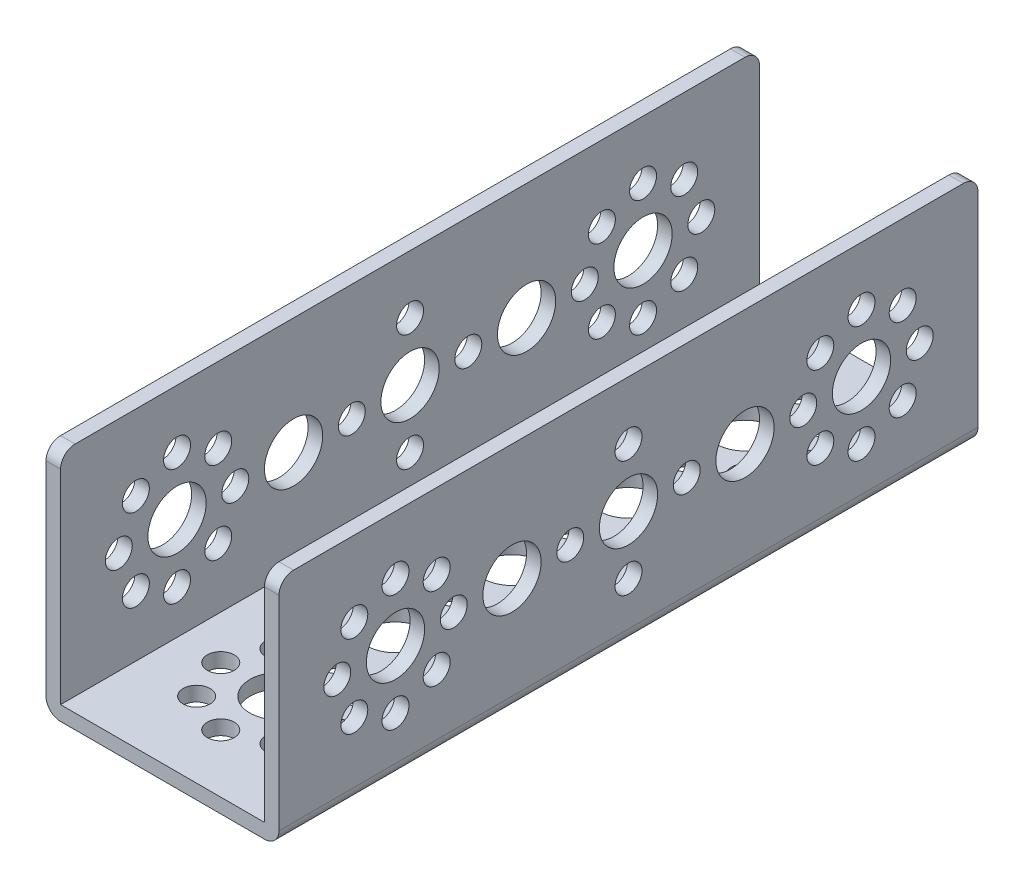
from build123d import *

# Parameters (mm, degrees)
BOSS_EXTRUDE1_DEPTH = 48
SKETCH2_R           = 4
SKETCH2_R_2         = 1.85
CUT_EXTRUDE1_DEPTH  = 32
SKETCH6_R           = 4
SKETCH6_R_2         = 1.85
CUT_EXTRUDE2_DEPTH  = 2
FILLET1_R           = 2


with BuildPart() as part:
    # Sketch1 → Boss-Extrude1 (new, symmetric)
    with BuildSketch(Plane.XY):
        with BuildLine():
            Line((-14, 0), (14, 0))
            ThreePointArc((14, 0), (15.414213562, 0.585786438), (16, 2))
            Line((16, 2), (16, 32))
            Line((16, 32), (14, 32))
            Line((14, 32), (14, 2))
            Line((14, 2), (-14, 2))
            Line((-14, 2), (-14, 32))
            Line((-14, 32), (-16, 32))
            Line((-16, 32), (-16, 2))
            ThreePointArc((-16, 2), (-15.414213562, 0.585786438), (-14, 0))
        make_face()
    extrude(amount=BOSS_EXTRUDE1_DEPTH, both=True)

    # Sketch2 → Cut-Extrude1 (cut)
    with BuildSketch(Plane(origin=(16, 0, 0), x_dir=(0, 0, -1), z_dir=(1, 0, 0))):
        with Locations((0, 16)):
            Circle(SKETCH2_R)
        with Locations((8, 16)):
            Circle(SKETCH2_R_2)
        with Locations((-8, 16)):
            Circle(SKETCH2_R_2)
        with Locations((0, 8)):
            Circle(SKETCH2_R_2)
        with Locations((0, 24)):
            Circle(SKETCH2_R_2)
        with Locations((-16, 16)):
            Circle(SKETCH2_R)
        with Locations((16, 16)):
            Circle(SKETCH2_R)
        with Locations((40, 16)):
            Circle(SKETCH2_R_2)
        with Locations((32, 8)):
            Circle(SKETCH2_R_2)
        with Locations((32, 16)):
            Circle(SKETCH2_R)
        with Locations((32, 24)):
            Circle(SKETCH2_R_2)
        with Locations((26.343145751, 21.656854249)):
            Circle(SKETCH2_R_2)
        with Locations((26.343145751, 10.343145751)):
            Circle(SKETCH2_R_2)
        with Locations((24, 16)):
            Circle(SKETCH2_R_2)
        with Locations((37.656854249, 21.656854249)):
            Circle(SKETCH2_R_2)
        with Locations((37.656854249, 10.343145751)):
            Circle(SKETCH2_R_2)
        with Locations((-24, 16)):
            Circle(SKETCH2_R_2)
        with Locations((-32, 8)):
            Circle(SKETCH2_R_2)
        with Locations((-32, 16)):
            Circle(SKETCH2_R)
        with Locations((-32, 24)):
            Circle(SKETCH2_R_2)
        with Locations((-37.656854249, 21.656854249)):
            Circle(SKETCH2_R_2)
        with Locations((-37.656854249, 10.343145751)):
            Circle(SKETCH2_R_2)
        with Locations((-40, 16)):
            Circle(SKETCH2_R_2)
        with Locations((-26.343145751, 21.656854249)):
            Circle(SKETCH2_R_2)
        with Locations((-26.343145751, 10.343145751)):
            Circle(SKETCH2_R_2)
    extrude(amount=-CUT_EXTRUDE1_DEPTH, mode=Mode.SUBTRACT)

    # Sketch6 → Cut-Extrude2 (cut)
    with BuildSketch(Plane(origin=(0, 2, 0), x_dir=(1, 0, 0), z_dir=(0, 1, 0))):
        with Locations(Location((0, 0, 0), (0, 0, 180))):
            Circle(SKETCH6_R)
        with Locations(Location((0, 8, 0), (0, 0, 180))):
            Circle(SKETCH6_R_2)
        with Locations(Location((0, -8, 0), (0, 0, 180))):
            Circle(SKETCH6_R_2)
        with Locations(Location((8, 0, 0), (0, 0, 180))):
            Circle(SKETCH6_R_2)
        with Locations(Location((-8, 0, 0), (0, 0, 180))):
            Circle(SKETCH6_R_2)
        with Locations(Location((0, -16, 0), (0, 0, 180))):
            Circle(SKETCH6_R)
        with Locations(Location((0, 16, 0), (0, 0, 180))):
            Circle(SKETCH6_R)
        with Locations(Location((0, 24, 0), (0, 0, 180))):
            Circle(SKETCH6_R_2)
        with Locations(Location((-8, 32, 0), (0, 0, 180))):
            Circle(SKETCH6_R_2)
        with Locations(Location((0, 32, 0), (0, 0, 180))):
            Circle(SKETCH6_R)
        with Locations(Location((8, 32, 0), (0, 0, 180))):
            Circle(SKETCH6_R_2)
        with Locations(Location((5.656854249, 37.656854249, 0), (0, 0, 180))):
            Circle(SKETCH6_R_2)
        with Locations(Location((-5.656854249, 37.656854249, 0), (0, 0, 180))):
            Circle(SKETCH6_R_2)
        with Locations(Location((0, 40, 0), (0, 0, 180))):
            Circle(SKETCH6_R_2)
        with Locations(Location((5.656854249, 26.343145751, 0), (0, 0, 180))):
            Circle(SKETCH6_R_2)
        with Locations(Location((-5.656854249, 26.343145751, 0), (0, 0, 180))):
            Circle(SKETCH6_R_2)
        with Locations(Location((0, -40, 0), (0, 0, 180))):
            Circle(SKETCH6_R_2)
        with Locations(Location((-8, -32, 0), (0, 0, 180))):
            Circle(SKETCH6_R_2)
        with Locations(Location((0, -32, 0), (0, 0, 180))):
            Circle(SKETCH6_R)
        with Locations(Location((8, -32, 0), (0, 0, 180))):
            Circle(SKETCH6_R_2)
        with Locations(Location((5.656854249, -26.343145751, 0), (0, 0, 180))):
            Circle(SKETCH6_R_2)
        with Locations(Location((-5.656854249, -26.343145751, 0), (0, 0, 180))):
            Circle(SKETCH6_R_2)
        with Locations(Location((0, -24, 0), (0, 0, 180))):
            Circle(SKETCH6_R_2)
        with Locations(Location((5.656854249, -37.656854249, 0), (0, 0, 180))):
            Circle(SKETCH6_R_2)
        with Locations(Location((-5.656854249, -37.656854249, 0), (0, 0, 180))):
            Circle(SKETCH6_R_2)
    extrude(amount=-CUT_EXTRUDE2_DEPTH, mode=Mode.SUBTRACT)

    # Fillet1
    fillet1_edges = [part.edges().sort_by_distance(p)[0] for p in [
        (15, 32, -48),
        (15, 32, 48),
        (-15, 32, 48),
        (-15, 32, -48),
    ]]
    fillet(fillet1_edges, radius=FILLET1_R)


solid = part.part
